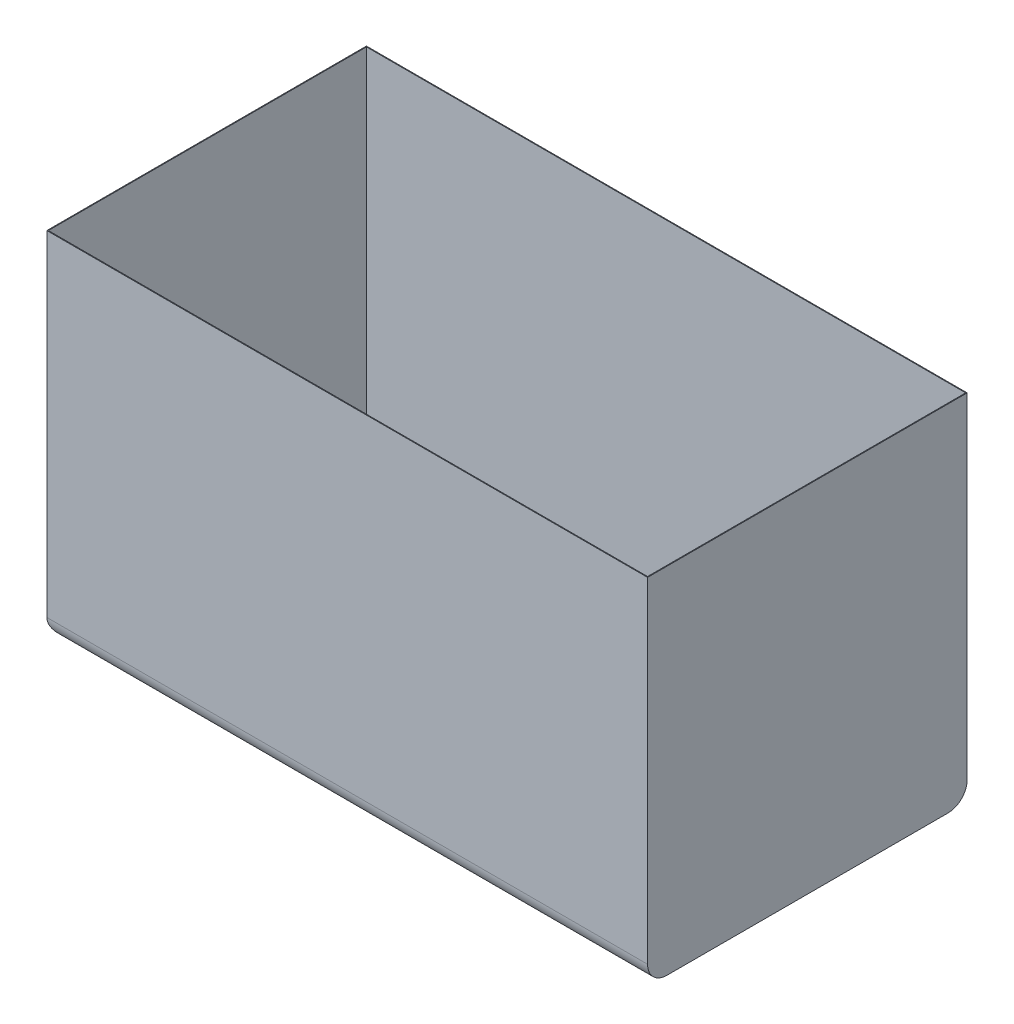
from build123d import *

# Parameters (mm, degrees)
SKETCH1_W           = 780
SKETCH1_H           = 415
BOSS_EXTRUDE1_DEPTH = 460
FILLET1_R           = 25
SHELL1_T            = -1
CUT_EXTRUDE2_REACH  = 998.105
SKETCH2_R           = 3.175


with BuildPart() as part:
    # Sketch1 → Boss-Extrude1 (new body)
    with BuildSketch(Plane(origin=(0, 0, 0), x_dir=(1, 0, 0), z_dir=(0, 1, 0))):
        with Locations((390, -207.5)):
            Rectangle(SKETCH1_W, SKETCH1_H)
    extrude(amount=BOSS_EXTRUDE1_DEPTH)

    # Fillet1
    fillet1_edges = [part.edges().sort_by_distance(p)[0] for p in [
        (390, 0, 0),
        (390, 0, 415),
        (0, 0, 207.5),
    ]]
    fillet(fillet1_edges, radius=FILLET1_R)

    # Shell1
    shell1_openings = [part.faces().sort_by_distance(p)[0] for p in [
        (390, 460, 207.5),
    ]]
    offset(amount=SHELL1_T, openings=shell1_openings)

    # Sketch2 → Cut-Extrude2 (cut, up to next)
    with BuildSketch(Plane.XZ, mode=Mode.PRIVATE) as cut_extrude2_sk1:
        with Locations(Location((65, 164, 0), (0, 0, 270))):
            Circle(SKETCH2_R)
    cut_extrude2_tool1 = extrude(cut_extrude2_sk1.sketch, amount=-CUT_EXTRUDE2_REACH, mode=Mode.PRIVATE) & part.part
    # Sketch2 → Cut-Extrude2 (cut, up to next)
    with BuildSketch(Plane.XZ, mode=Mode.PRIVATE) as cut_extrude2_sk2:
        with Locations(Location((152, 164, 0), (0, 0, 270))):
            Circle(SKETCH2_R)
    cut_extrude2_tool2 = extrude(cut_extrude2_sk2.sketch, amount=-CUT_EXTRUDE2_REACH, mode=Mode.PRIVATE) & part.part
    # Sketch2 → Cut-Extrude2 (cut, up to next)
    with BuildSketch(Plane.XZ, mode=Mode.PRIVATE) as cut_extrude2_sk3:
        with Locations(Location((239, 164, 0), (0, 0, 270))):
            Circle(SKETCH2_R)
    cut_extrude2_tool3 = extrude(cut_extrude2_sk3.sketch, amount=-CUT_EXTRUDE2_REACH, mode=Mode.PRIVATE) & part.part
    # Sketch2 → Cut-Extrude2 (cut, up to next)
    with BuildSketch(Plane.XZ, mode=Mode.PRIVATE) as cut_extrude2_sk4:
        with Locations(Location((326, 164, 0), (0, 0, 270))):
            Circle(SKETCH2_R)
    cut_extrude2_tool4 = extrude(cut_extrude2_sk4.sketch, amount=-CUT_EXTRUDE2_REACH, mode=Mode.PRIVATE) & part.part
    # Sketch2 → Cut-Extrude2 (cut, up to next)
    with BuildSketch(Plane.XZ, mode=Mode.PRIVATE) as cut_extrude2_sk5:
        with Locations(Location((413, 164, 0), (0, 0, 270))):
            Circle(SKETCH2_R)
    cut_extrude2_tool5 = extrude(cut_extrude2_sk5.sketch, amount=-CUT_EXTRUDE2_REACH, mode=Mode.PRIVATE) & part.part
    # Sketch2 → Cut-Extrude2 (cut, up to next)
    with BuildSketch(Plane.XZ, mode=Mode.PRIVATE) as cut_extrude2_sk6:
        with Locations(Location((500, 164, 0), (0, 0, 270))):
            Circle(SKETCH2_R)
    cut_extrude2_tool6 = extrude(cut_extrude2_sk6.sketch, amount=-CUT_EXTRUDE2_REACH, mode=Mode.PRIVATE) & part.part
    # Sketch2 → Cut-Extrude2 (cut, up to next)
    with BuildSketch(Plane.XZ, mode=Mode.PRIVATE) as cut_extrude2_sk7:
        with Locations(Location((587, 164, 0), (0, 0, 270))):
            Circle(SKETCH2_R)
    cut_extrude2_tool7 = extrude(cut_extrude2_sk7.sketch, amount=-CUT_EXTRUDE2_REACH, mode=Mode.PRIVATE) & part.part
    # Sketch2 → Cut-Extrude2 (cut, up to next)
    with BuildSketch(Plane.XZ, mode=Mode.PRIVATE) as cut_extrude2_sk8:
        with Locations(Location((674, 164, 0), (0, 0, 270))):
            Circle(SKETCH2_R)
    cut_extrude2_tool8 = extrude(cut_extrude2_sk8.sketch, amount=-CUT_EXTRUDE2_REACH, mode=Mode.PRIVATE) & part.part
    add(cut_extrude2_tool1.solids().sort_by_distance((65, 0, 164))[0], mode=Mode.SUBTRACT)
    add(cut_extrude2_tool2.solids().sort_by_distance((152, 0, 164))[0], mode=Mode.SUBTRACT)
    add(cut_extrude2_tool3.solids().sort_by_distance((239, 0, 164))[0], mode=Mode.SUBTRACT)
    add(cut_extrude2_tool4.solids().sort_by_distance((326, 0, 164))[0], mode=Mode.SUBTRACT)
    add(cut_extrude2_tool5.solids().sort_by_distance((413, 0, 164))[0], mode=Mode.SUBTRACT)
    add(cut_extrude2_tool6.solids().sort_by_distance((500, 0, 164))[0], mode=Mode.SUBTRACT)
    add(cut_extrude2_tool7.solids().sort_by_distance((587, 0, 164))[0], mode=Mode.SUBTRACT)
    add(cut_extrude2_tool8.solids().sort_by_distance((674, 0, 164))[0], mode=Mode.SUBTRACT)


solid = part.part
